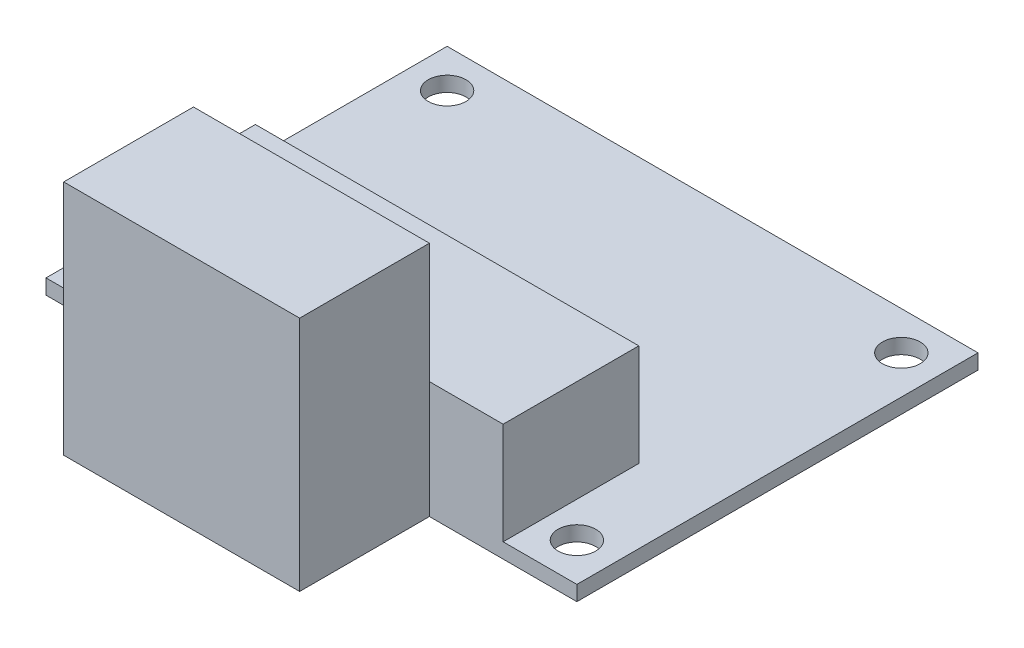
from build123d import *

# Parameters (mm, degrees)
SKETCH1_W            = 45
SKETCH1_H            = 45
BOSS_EXTRUDE1_DEPTH  = 10.033
SKETCH2_W            = 12.5
SKETCH2_H            = 11
CUT_EXTRUDE1_DEPTH   = 20.066
CUT_EXTRUDE2_DEPTH   = 18.796
CUT_EXTRUDE3_DEPTH   = 10.16
M3_CLEARANCE_HOLE1_D = 3.2


with BuildPart() as part:
    # Sketch1 → Boss-Extrude1 (new, symmetric)
    with BuildSketch(Plane(origin=(0, 0, 0), x_dir=(1, 0, 0), z_dir=(0, 1, 0))):
        Rectangle(SKETCH1_W, SKETCH1_H)
    extrude(amount=BOSS_EXTRUDE1_DEPTH, both=True)

    # Sketch2 → Cut-Extrude1 (cut)
    with BuildSketch(Plane(origin=(0, 10.033, 0), x_dir=(1, 0, 0), z_dir=(0, 1, 0))):
        with Locations((16.25, -17)):
            Rectangle(SKETCH2_W, SKETCH2_H)
    cut_extrude1 = extrude(amount=-CUT_EXTRUDE1_DEPTH, mode=Mode.SUBTRACT)

    # Mirror1: Cut-Extrude1 across plane
    add(cut_extrude1.mirror(Plane(origin=(0, 0, 0), x_dir=(0, 0, 1), z_dir=(1, 0, 0))), mode=Mode.SUBTRACT)

    # Sketch3 → Cut-Extrude2 (cut)
    with BuildSketch(Plane(origin=(0, 10.033, 0), x_dir=(1, 0, 0), z_dir=(0, 1, 0))):
        Polygon((-22.5, -11.5), (-16.25, -11.5), (-16.25, 0), (16.248560403, 0), (16.248560403, -11.5), (22.5, -11.5), (22.5, 22.5), (-22.5, 22.5), align=None)
    extrude(amount=-CUT_EXTRUDE2_DEPTH, mode=Mode.SUBTRACT)

    # Sketch3<3> → Cut-Extrude3 (cut)
    with BuildSketch(Plane(origin=(0, 10.033, 0), x_dir=(1, 0, 0), z_dir=(0, 1, 0))):
        Polygon((-16.25, 0), (-16.25, -11.5), (-10, -11.5), (10, -11.5), (16.248560403, -11.5), (16.248560403, 0), align=None)
    extrude(amount=-CUT_EXTRUDE3_DEPTH, mode=Mode.SUBTRACT)

    # M3 Clearance Hole1 (through all)
    with Locations(Plane(origin=(0, -8.763, 0), x_dir=(1, 0, 0), z_dir=(0, 1, 0))):
        with Locations((-19.25, 19.25), (-19.25, -8.25), (19.25, -8.25), (19.25, 19.25)):
            Hole(M3_CLEARANCE_HOLE1_D / 2)


solid = part.part
